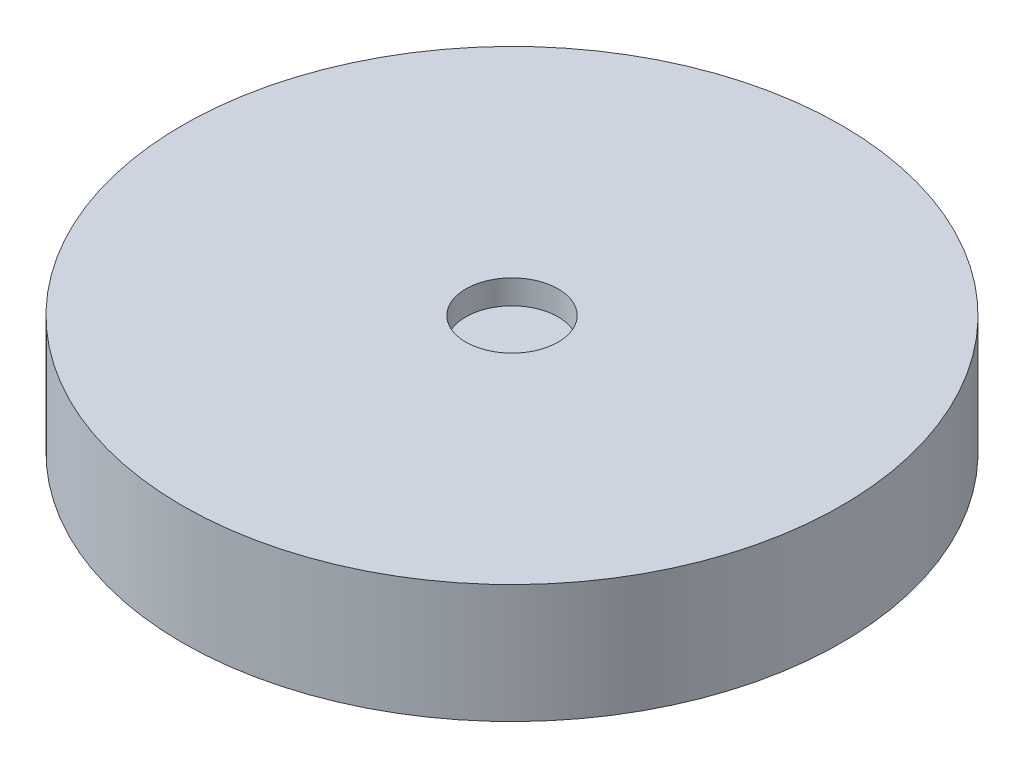
from build123d import *

# Parameters (mm, degrees)
CROQUIS1_R              = 25
SALIENTE_EXTRUIR1_DEPTH = 9
CROQUIS2_R              = 3.5
CORTAR_EXTRUIR1_DEPTH   = 1.8375


with BuildPart() as part:
    # Croquis1 → Saliente-Extruir1 (new body)
    with BuildSketch(Plane(origin=(0, 0, 0), x_dir=(1, 0, 0), z_dir=(0, 1, 0))):
        with Locations(Location((0, 0, 0), (0, 0, 270))):
            Circle(CROQUIS1_R)
    extrude(amount=SALIENTE_EXTRUIR1_DEPTH)

    # Croquis2 → Cortar-Extruir1 (cut)
    with BuildSketch(Plane(origin=(0, 9, 0), x_dir=(1, 0, 0), z_dir=(0, 1, 0))):
        with Locations(Location((0, 0, 0), (0, 0, 270))):
            Circle(CROQUIS2_R)
    extrude(amount=-CORTAR_EXTRUIR1_DEPTH, mode=Mode.SUBTRACT)


solid = part.part
